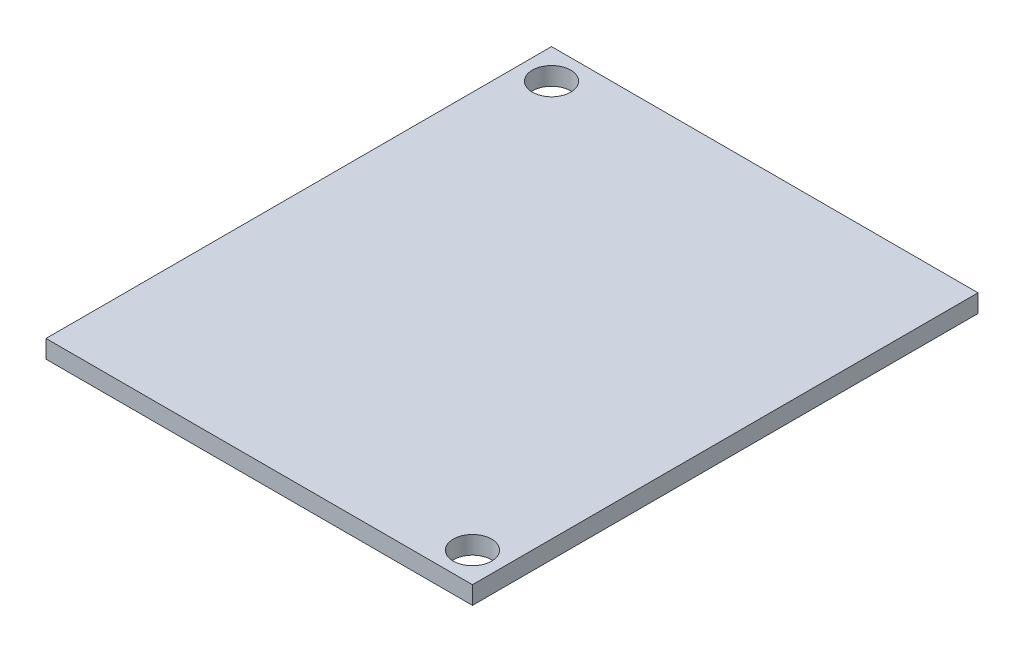
from build123d import *

# Parameters (mm, degrees)
SKETCH1_W           = 35.6
SKETCH1_H           = 42.2
SKETCH1_R           = 1.6
BOSS_EXTRUDE1_DEPTH = 1.5


with BuildPart() as part:
    # Sketch1 → Boss-Extrude1 (new body)
    with BuildSketch(Plane(origin=(0, 0, 0), x_dir=(1, 0, 0), z_dir=(0, 1, 0))):
        Rectangle(SKETCH1_W, SKETCH1_H)
        with Locations(Location((-15.3, 18.6, 0), (0, 0, 270))):
            Circle(SKETCH1_R, mode=Mode.SUBTRACT)
        with Locations(Location((15.3, -18.6, 0), (0, 0, 270))):
            Circle(SKETCH1_R, mode=Mode.SUBTRACT)
    extrude(amount=BOSS_EXTRUDE1_DEPTH)


solid = part.part
